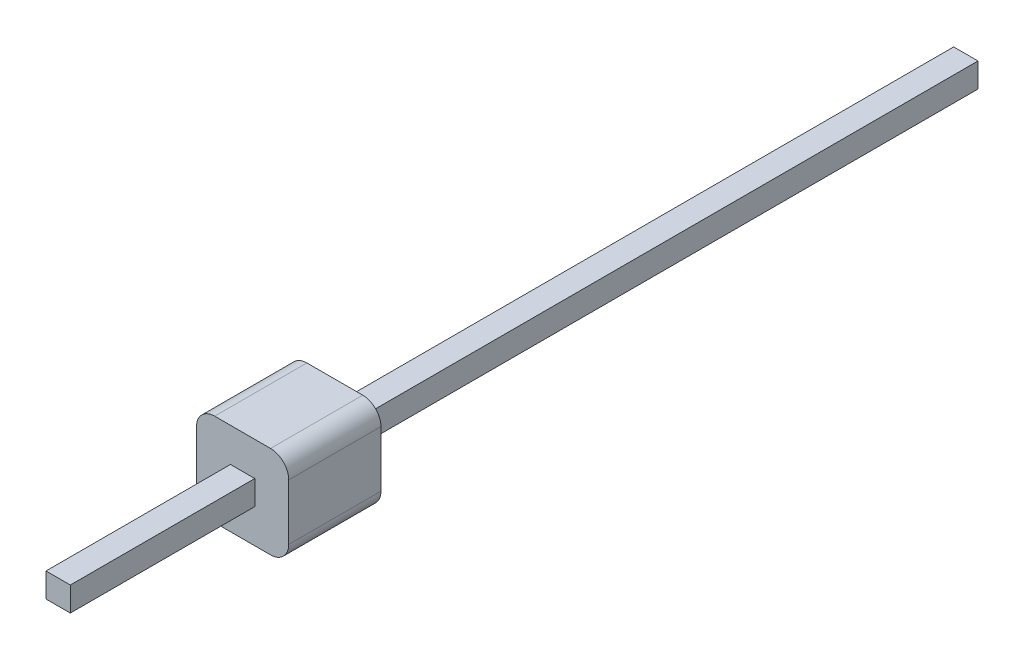
from build123d import *

# Parameters (mm, degrees)
SKETCH_1_W      = 2.54
SKETCH_1_H      = 2.54
EXTRUDE_1_DEPTH = 2.54
SKETCH_2_W      = 0.67
SKETCH_2_H      = 0.67
FILLET_1_R      = 0.5


with BuildPart() as part:
    # 草图1 → 拉伸1 (new body)
    with BuildSketch(Plane.XY):
        with Locations((0, -1.289090726)):
            Rectangle(SKETCH_1_W, SKETCH_1_H)
    extrude(amount=EXTRUDE_1_DEPTH)

    # 扫描1: sweep along a path in 草图3
    with BuildLine(Plane(origin=(0, 0, 0), x_dir=(0, 0, -1), z_dir=(1, 0, 0))) as sweep_1_path:
        Line((17.38, -1.299090726), (-7.62, -1.299090726))
    # 草图2 → 扫描1 (sweep)
    with BuildSketch(Plane(origin=(0, 0, 7.62), x_dir=(-1, 0, 0), z_dir=(0, 0, -1))):
        with Locations((0, -1.289090726)):
            Rectangle(SKETCH_2_W, SKETCH_2_H)
    sweep(path=sweep_1_path.line)

    # 圆角1
    fillet_1_edges = [part.edges().sort_by_distance(p)[0] for p in [
        (-1.27, -0.019090726, 1.27),
        (1.27, -0.019090726, 1.27),
        (1.27, -2.559090726, 1.27),
        (-1.27, -2.559090726, 1.27),
    ]]
    fillet(fillet_1_edges, radius=FILLET_1_R)


solid = part.part
